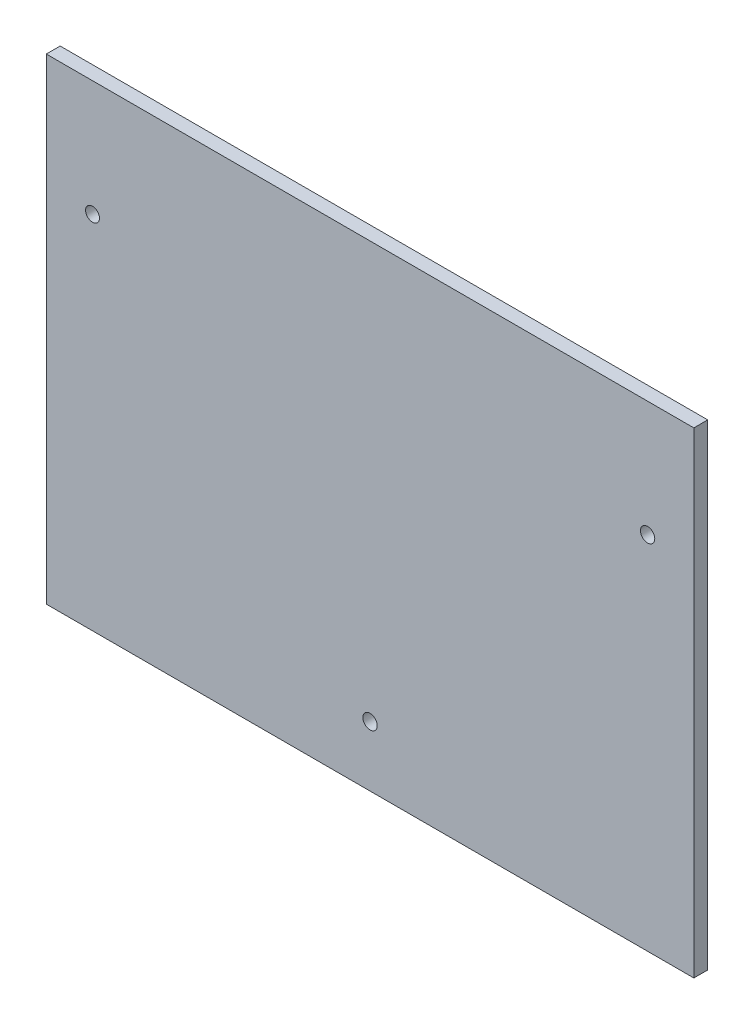
from build123d import *

# Parameters (mm, degrees)
SKETCH_1_W          = 140
SKETCH_1_H          = 103
EXTRUDE_1_DEPTH     = 3
SKETCH_2_R          = 1.5
SKETCH_2_R_2        = 1.55
CUT_EXTRUDE_1_DEPTH = 87.955448363


with BuildPart() as part:
    # 草图1 → 凸台-拉伸1 (new body)
    with BuildSketch(Plane.XY):
        Rectangle(SKETCH_1_W, SKETCH_1_H)
    extrude(amount=EXTRUDE_1_DEPTH)

    # 草图2 → 切除-拉伸1 (cut, through all)
    with BuildSketch(Plane.XY.offset(3)):
        with Locations((-60, 26.5)):
            Circle(SKETCH_2_R)
        with Locations((60, 26.5)):
            Circle(SKETCH_2_R_2)
        with Locations((0, -38.5)):
            Circle(SKETCH_2_R_2)
    extrude(amount=-CUT_EXTRUDE_1_DEPTH, mode=Mode.SUBTRACT)


solid = part.part
